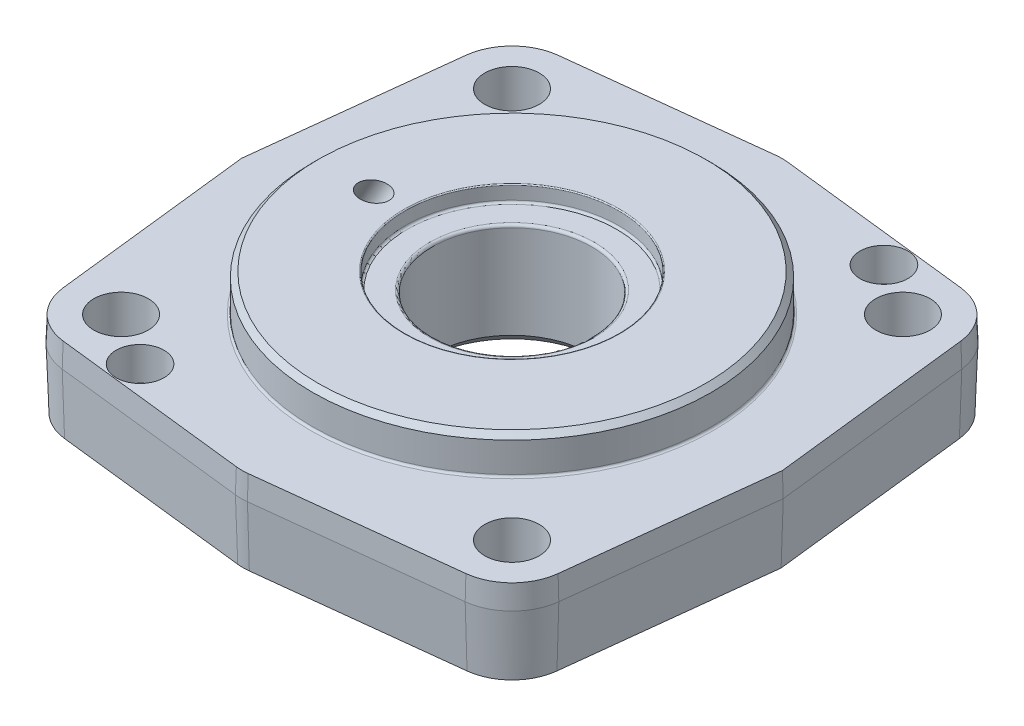
from build123d import *

# Parameters (mm, degrees)
BOSS_EXTRUDE1_DEPTH                          = 11.5
BOSS_EXTRUDE1_TAPER                          = 2
BOSS_EXTRUDE1_OTHER_WAY_DEPTH                = 11.5
BOSS_EXTRUDE1_OTHER_WAY_TAPER                = 2
SKETCH5_R                                    = 5.125
CUT_EXTRUDE3_DEPTH                           = 76.659835157
SKETCH4_R                                    = 44
SKETCH4_R_2                                  = 41.375
CUT_EXTRUDE2_DEPTH                           = 1.75
CBORE_FOR_M5_HEX_SOCKET_HEAD_CAP_SCR_2_COUNT = 2
CBORE_FOR_M5_HEX_SOCKET_HEAD_CAP_SCR_2_PITCH = 101.5


with BuildPart() as part:
    # Sketch2 → Boss-Extrude1 (new body)
    with BuildSketch(Plane(origin=(0, 0, 0), x_dir=(1, 0, 0), z_dir=(0, 1, 0))):
        with BuildLine():
            ThreePointArc((1.131558067, 50.871129935), (0, 50.935357376), (-1.131558067, 50.871129935))
            Line((-1.131558067, 50.871129935), (-37.881558067, 46.685772559))
            ThreePointArc((-37.881558067, 46.685772559), (-43.821067812, 43.821067812), (-46.685772559, 37.881558067))
            Line((-46.685772559, 37.881558067), (-51, 0))
            Line((-51, 0), (-46.685772559, -37.881558067))
            ThreePointArc((-46.685772559, -37.881558067), (-43.821067812, -43.821067812), (-37.881558067, -46.685772559))
            Line((-37.881558067, -46.685772559), (-1.131558067, -50.871129935))
            ThreePointArc((-1.131558067, -50.871129935), (0, -50.935357376), (1.131558067, -50.871129935))
            Line((1.131558067, -50.871129935), (37.881558067, -46.685772559))
            ThreePointArc((37.881558067, -46.685772559), (43.821067812, -43.821067812), (46.685772559, -37.881558067))
            Line((46.685772559, -37.881558067), (51, 0))
            Line((51, 0), (46.685772559, 37.881558067))
            ThreePointArc((46.685772559, 37.881558067), (43.821067812, 43.821067812), (37.881558067, 46.685772559))
            Line((37.881558067, 46.685772559), (1.131558067, 50.871129935))
        make_face()
    extrude(amount=BOSS_EXTRUDE1_DEPTH, taper=BOSS_EXTRUDE1_TAPER)

    # Sketch2 → Boss-Extrude1 other way (add)
    with BuildSketch(Plane(origin=(0, 0, 0), x_dir=(1, 0, 0), z_dir=(0, 1, 0))):
        with BuildLine():
            ThreePointArc((1.131558067, 50.871129935), (0, 50.935357376), (-1.131558067, 50.871129935))
            Line((-1.131558067, 50.871129935), (-37.881558067, 46.685772559))
            ThreePointArc((-37.881558067, 46.685772559), (-43.821067812, 43.821067812), (-46.685772559, 37.881558067))
            Line((-46.685772559, 37.881558067), (-51, 0))
            Line((-51, 0), (-46.685772559, -37.881558067))
            ThreePointArc((-46.685772559, -37.881558067), (-43.821067812, -43.821067812), (-37.881558067, -46.685772559))
            Line((-37.881558067, -46.685772559), (-1.131558067, -50.871129935))
            ThreePointArc((-1.131558067, -50.871129935), (0, -50.935357376), (1.131558067, -50.871129935))
            Line((1.131558067, -50.871129935), (37.881558067, -46.685772559))
            ThreePointArc((37.881558067, -46.685772559), (43.821067812, -43.821067812), (46.685772559, -37.881558067))
            Line((46.685772559, -37.881558067), (51, 0))
            Line((51, 0), (46.685772559, 37.881558067))
            ThreePointArc((46.685772559, 37.881558067), (43.821067812, 43.821067812), (37.881558067, 46.685772559))
            Line((37.881558067, 46.685772559), (1.131558067, 50.871129935))
        make_face()
    extrude(amount=-BOSS_EXTRUDE1_OTHER_WAY_DEPTH, taper=BOSS_EXTRUDE1_OTHER_WAY_TAPER)

    # Sketch5 → Cut-Extrude3 (cut, through all)
    with BuildSketch(Plane.XZ.offset(11.5)):
        with Locations(Location((-36.75, 36.75, 0), (0, 0, 270))):
            Circle(SKETCH5_R)
        with Locations(Location((36.75, 36.75, 0), (0, 0, 270))):
            Circle(SKETCH5_R)
        with Locations(Location((-36.75, -36.75, 0), (0, 0, 270))):
            Circle(SKETCH5_R)
        with Locations(Location((36.75, -36.75, 0), (0, 0, 270))):
            Circle(SKETCH5_R)
    extrude(amount=-CUT_EXTRUDE3_DEPTH, mode=Mode.SUBTRACT)

    # Sketch4 → Cut-Extrude2 (cut)
    with BuildSketch(Plane.XZ.offset(11.5)):
        with Locations(Location((0, 0, 0), (0, 0, 270))):
            Circle(SKETCH4_R)
        with Locations(Location((0, 0, 0), (0, 0, 270))):
            Circle(SKETCH4_R_2, mode=Mode.SUBTRACT)
    extrude(amount=-CUT_EXTRUDE2_DEPTH, mode=Mode.SUBTRACT)

    # Sketch6 → Cut-Revolve1 (revolve, cut)
    with BuildSketch(Plane(origin=(0, 0, 0), x_dir=(0, 0, -1), z_dir=(1, 0, 0)), mode=Mode.PRIVATE) as cut_revolve1_sk:
        with BuildLine():
            Line((37.45, 10.5), (37.45, 4.9))
            ThreePointArc((37.45, 4.9), (37.567157288, 4.617157288), (37.85, 4.5))
            Line((37.85, 4.5), (75, 4.5))
            Line((75, 4.5), (75, 13.5))
            Line((75, 13.5), (0, 13.5))
            Line((0, 13.5), (0, -11.5))
            Line((0, -11.5), (17, -11.5))
            Line((17, -11.5), (15, -9.5))
            Line((15, -9.5), (15, 8))
            ThreePointArc((15, 8), (15.146446609, 8.353553391), (15.5, 8.5))
            Line((15.5, 8.5), (19.7, 8.5))
            ThreePointArc((19.7, 8.5), (19.982842712, 8.617157288), (20.1, 8.9))
            Line((20.1, 8.9), (20.1, 11.3))
            ThreePointArc((20.1, 11.3), (20.158578644, 11.441421356), (20.3, 11.5))
            Line((20.3, 11.5), (36.45, 11.5))
            Line((36.45, 11.5), (37.45, 10.5))
        make_face()
    revolve(cut_revolve1_sk.sketch.rotate(Axis((0, 29.196100586, 0), (0, -1, 0)), 180), axis=Axis((0, 29.196100586, 0), (0, -1, 0)), mode=Mode.SUBTRACT)

    # Sketch9 → Cut-Revolve2 (revolve, cut)
    with BuildSketch(Plane.XY, mode=Mode.PRIVATE) as cut_revolve2_sk:
        Polygon((-37.34396054, -12.765501422), (-23.84396054, 10.234498578), (-22.346696913, 12.785392166), (-24.502736372, 14.050893588), (-43.54960455, -18.399326271), (-41.393565091, -19.664827692), align=None)
    revolve(cut_revolve2_sk.sketch.rotate(Axis((-43.54960455, -18.399326271, 0), (0.5062005687642237, 0.8624157838205285, 0)), 230.866713555), axis=Axis((-43.54960455, -18.399326271, 0), (0.5062005687642237, 0.8624157838205285, 0)), mode=Mode.SUBTRACT)

    # Sketch12 → CBORE for M5 Hex Socket Head Cap Screw1 (revolve, cut)
    with BuildSketch(Plane(origin=(26.89340266, 4.5, -43.03844088), x_dir=(0, 0, 1), z_dir=(1, 0, 0))):
        Polygon((0, 0), (0, 16), (2.775, 16), (2.75, 15.975), (2.75, 6.325), (2.775, 6.3), (4.5, 6.3), (4.5, 0), align=None)
    cbore_for_m5_hex_socket_head_cap_screw1 = revolve(axis=Axis((26.89340266, 10.85, -43.03844088), (0, -1, 0)), mode=Mode.SUBTRACT)

    # CBORE for M5 Hex Socket Head Cap Scr 2: CBORE for M5 Hex Socket Head Cap Screw1 ×2
    with Locations(*[Vector(-0.5299192642331998, 0, 0.8480480961564293) * (i * CBORE_FOR_M5_HEX_SOCKET_HEAD_CAP_SCR_2_PITCH) for i in range(1, CBORE_FOR_M5_HEX_SOCKET_HEAD_CAP_SCR_2_COUNT)]):
        add(cbore_for_m5_hex_socket_head_cap_screw1, mode=Mode.SUBTRACT)


solid = part.part
